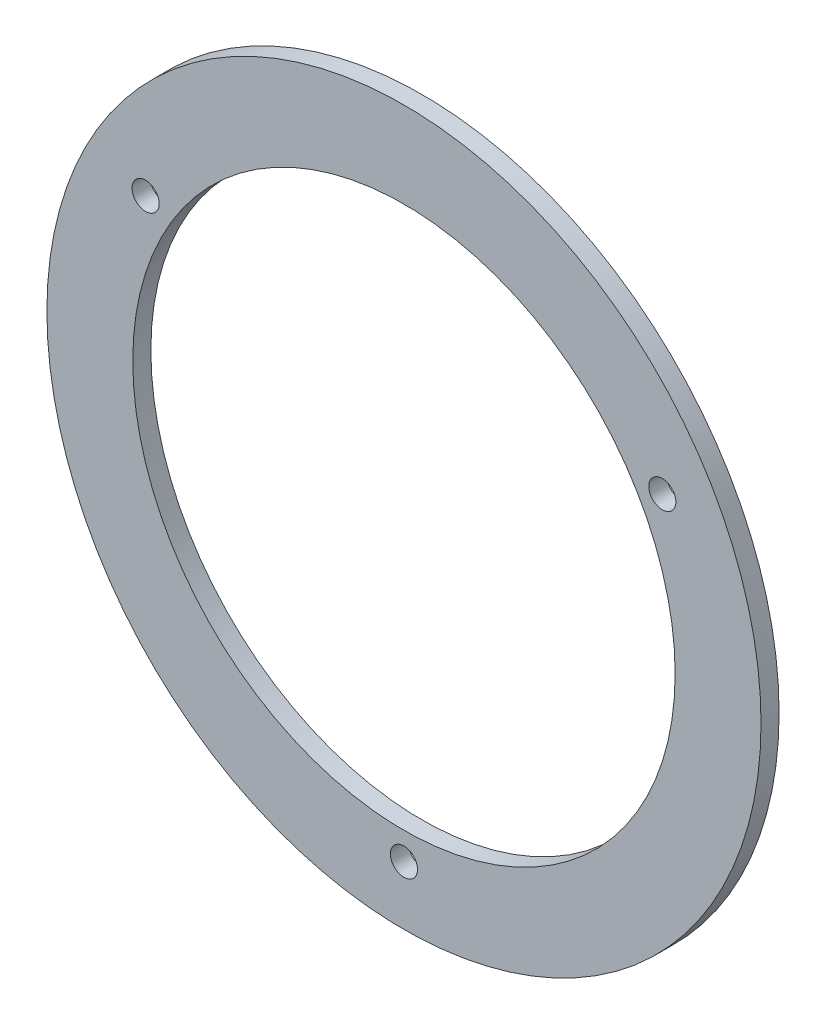
from build123d import *

# Parameters (mm, degrees)
SKETCH_1_R          = 39.5
SKETCH_1_R_2        = 30
EXTRUDE_1_DEPTH     = 2
SKETCH_2_R          = 1.5
CUT_EXTRUDE_1_DEPTH = 2


with BuildPart() as part:
    # 草图1 → 凸台-拉伸1 (new body)
    with BuildSketch(Plane.XY):
        Circle(SKETCH_1_R)
        Circle(SKETCH_1_R_2, mode=Mode.SUBTRACT)
    extrude(amount=EXTRUDE_1_DEPTH)

    # 草图2 → 切除-拉伸1 (cut)
    with BuildSketch(Plane.XY.offset(2)):
        with Locations((0, -33)):
            Circle(SKETCH_2_R)
        with Locations((-28.578838325, 16.5)):
            Circle(SKETCH_2_R)
        with Locations((28.578838325, 16.5)):
            Circle(SKETCH_2_R)
    extrude(amount=-CUT_EXTRUDE_1_DEPTH, mode=Mode.SUBTRACT)


solid = part.part
